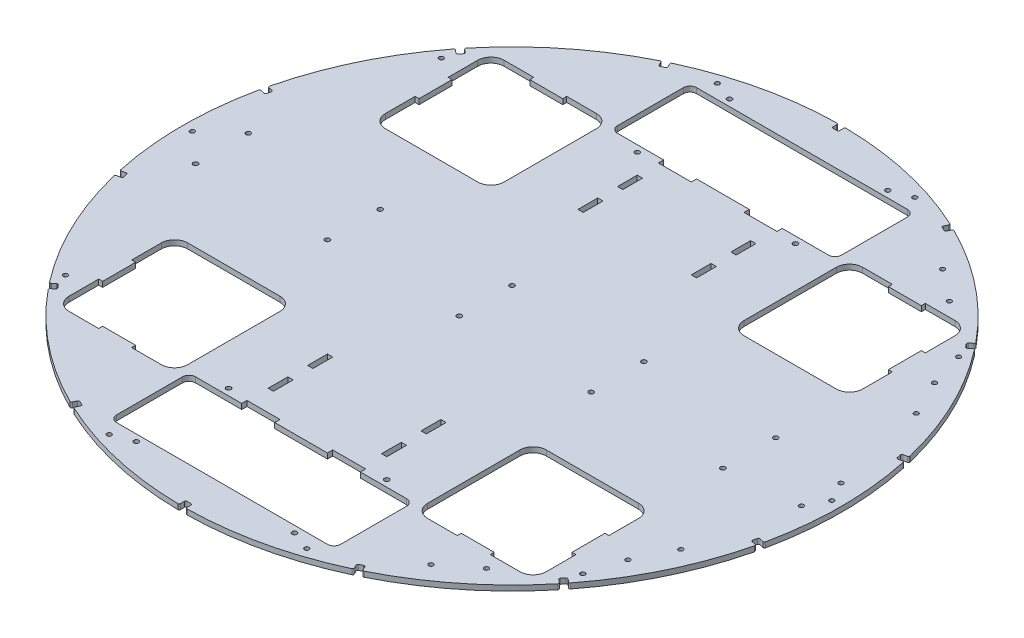
from build123d import *

# Parameters (mm, degrees)
SKETCH1_R                = 250
BOSS_EXTRUDE1_DEPTH      = 4
CUT_EXTRUDE1_DEPTH       = 10
SKETCH3_W                = 25
SKETCH3_H                = 4
CUT_EXTRUDE2_DEPTH       = 5
SKETCH4_W                = 4
SKETCH4_H                = 15
CUT_EXTRUDE3_DEPTH       = 20
CUT_EXTRUDE4_DEPTH       = 5
SKETCH8_W                = 6
SKETCH8_H                = 25
SKETCH8_W_2              = 25
SKETCH8_H_2              = 6
BOSS_EXTRUDE2_DEPTH      = 4
CUT_EXTRUDE5_DEPTH       = 4
FILLET1_R                = 1
CIRPATTERN1_COUNT        = 14
FILLET1_OF_CIRPATTERN1_R = 1
SKETCH12_R               = 1.7
CUT_EXTRUDE6_DEPTH       = 10
CIRPATTERN2_COUNT        = 10
SKETCH13_R               = 1.7
CUT_EXTRUDE7_DEPTH       = 10
SKETCH14_R               = 1.8
CUT_EXTRUDE8_DEPTH       = 10
SKETCH15_R               = 1.8
CUT_EXTRUDE9_DEPTH       = 10


with BuildPart() as part:
    # Sketch1 → Boss-Extrude1 (new body)
    with BuildSketch(Plane(origin=(0, 0, 0), x_dir=(1, 0, 0), z_dir=(0, 1, 0))):
        with Locations(Location((0, 0, 0), (0, 0, 270))):
            Circle(SKETCH1_R)
    extrude(amount=BOSS_EXTRUDE1_DEPTH)

    # Sketch2 → Cut-Extrude1 (cut)
    with BuildSketch(Plane(origin=(0, 4, 0), x_dir=(1, 0, 0), z_dir=(0, 1, 0))):
        with BuildLine():
            Line((80, 220), (-80, 220))
            ThreePointArc((-80, 220), (-83.535533906, 218.535533906), (-85, 215))
            Line((-85, 215), (-85, 165))
            ThreePointArc((-85, 165), (-83.535533906, 161.464466094), (-80, 160))
            Line((-80, 160), (80, 160))
            ThreePointArc((80, 160), (83.535533906, 161.464466094), (85, 165))
            Line((85, 165), (85, 215))
            ThreePointArc((85, 215), (83.535533906, 218.535533906), (80, 220))
        make_face()
        with BuildLine():
            Line((85, -215), (85, -165))
            ThreePointArc((85, -165), (83.535533906, -161.464466094), (80, -160))
            Line((80, -160), (-80, -160))
            ThreePointArc((-80, -160), (-83.535533906, -161.464466094), (-85, -165))
            Line((-85, -165), (-85, -215))
            ThreePointArc((-85, -215), (-83.535533906, -218.535533906), (-80, -220))
            Line((-80, -220), (80, -220))
            ThreePointArc((80, -220), (83.535533906, -218.535533906), (85, -215))
        make_face()
    extrude(amount=-CUT_EXTRUDE1_DEPTH, mode=Mode.SUBTRACT)

    # Sketch3 → Cut-Extrude2 (cut)
    with BuildSketch(Plane(origin=(0, 4, 0), x_dir=(1, 0, 0), z_dir=(0, 1, 0))):
        with Locations((-32.5, 158)):
            Rectangle(SKETCH3_W, SKETCH3_H)
        with Locations((32.5, 158)):
            Rectangle(SKETCH3_W, SKETCH3_H)
        with Locations((-32.5, -158)):
            Rectangle(SKETCH3_W, SKETCH3_H)
        with Locations((32.5, -158)):
            Rectangle(SKETCH3_W, SKETCH3_H)
    extrude(amount=-CUT_EXTRUDE2_DEPTH, mode=Mode.SUBTRACT)

    # Sketch4 → Cut-Extrude3 (cut)
    with BuildSketch(Plane(origin=(0, 4, 0), x_dir=(1, 0, 0), z_dir=(0, 1, 0))):
        with Locations((43, 132.5)):
            Rectangle(SKETCH4_W, SKETCH4_H)
        with Locations((43, 102.5)):
            Rectangle(SKETCH4_W, SKETCH4_H)
        with Locations((-43, 132.5)):
            Rectangle(SKETCH4_W, SKETCH4_H)
        with Locations((-43, 102.5)):
            Rectangle(SKETCH4_W, SKETCH4_H)
        with Locations((-43, -102.5)):
            Rectangle(SKETCH4_W, SKETCH4_H)
        with Locations((-43, -132.5)):
            Rectangle(SKETCH4_W, SKETCH4_H)
        with Locations((43, -102.5)):
            Rectangle(SKETCH4_W, SKETCH4_H)
        with Locations((43, -132.5)):
            Rectangle(SKETCH4_W, SKETCH4_H)
    extrude(amount=-CUT_EXTRUDE3_DEPTH, mode=Mode.SUBTRACT)

    # Sketch7 → Cut-Extrude4 (cut)
    with BuildSketch(Plane(origin=(0, 4, 0), x_dir=(1, 0, 0), z_dir=(0, 1, 0))):
        with BuildLine():
            Line((-101, 75), (-171, 75))
            ThreePointArc((-171, 75), (-178.071067812, 77.928932188), (-181, 85))
            Line((-181, 85), (-181, 155))
            ThreePointArc((-181, 155), (-178.071067812, 162.071067812), (-171, 165))
            Line((-171, 165), (-101, 165))
            ThreePointArc((-101, 165), (-93.928932188, 162.071067812), (-91, 155))
            Line((-91, 155), (-91, 85))
            ThreePointArc((-91, 85), (-93.928932188, 77.928932188), (-101, 75))
        make_face()
        with BuildLine():
            Line((181, 85), (181, 155))
            ThreePointArc((181, 155), (178.071067812, 162.071067812), (171, 165))
            Line((171, 165), (101, 165))
            ThreePointArc((101, 165), (93.928932188, 162.071067812), (91, 155))
            Line((91, 155), (91, 85))
            ThreePointArc((91, 85), (93.928932188, 77.928932188), (101, 75))
            Line((101, 75), (171, 75))
            ThreePointArc((171, 75), (178.071067812, 77.928932188), (181, 85))
        make_face()
        with BuildLine():
            Line((101, -75), (171, -75))
            ThreePointArc((171, -75), (178.071067812, -77.928932188), (181, -85))
            Line((181, -85), (181, -155))
            ThreePointArc((181, -155), (178.071067812, -162.071067812), (171, -165))
            Line((171, -165), (101, -165))
            ThreePointArc((101, -165), (93.928932188, -162.071067812), (91, -155))
            Line((91, -155), (91, -85))
            ThreePointArc((91, -85), (93.928932188, -77.928932188), (101, -75))
        make_face()
        with BuildLine():
            Line((-181, -85), (-181, -155))
            ThreePointArc((-181, -155), (-178.071067812, -162.071067812), (-171, -165))
            Line((-171, -165), (-101, -165))
            ThreePointArc((-101, -165), (-93.928932188, -162.071067812), (-91, -155))
            Line((-91, -155), (-91, -85))
            ThreePointArc((-91, -85), (-93.928932188, -77.928932188), (-101, -75))
            Line((-101, -75), (-171, -75))
            ThreePointArc((-171, -75), (-178.071067812, -77.928932188), (-181, -85))
        make_face()
    extrude(amount=-CUT_EXTRUDE4_DEPTH, mode=Mode.SUBTRACT)

    # Sketch8 → Boss-Extrude2 (add)
    with BuildSketch(Plane(origin=(0, 4, 0), x_dir=(1, 0, 0), z_dir=(0, 1, 0))):
        with Locations((-181, 120)):
            Rectangle(SKETCH8_W, SKETCH8_H)
        with Locations((-136, 165)):
            Rectangle(SKETCH8_W_2, SKETCH8_H_2)
        with Locations((136, 165)):
            Rectangle(SKETCH8_W_2, SKETCH8_H_2)
        with Locations((181, 120)):
            Rectangle(SKETCH8_W, SKETCH8_H)
        with Locations((181, -120)):
            Rectangle(SKETCH8_W, SKETCH8_H)
        with Locations((136, -165)):
            Rectangle(SKETCH8_W_2, SKETCH8_H_2)
        with Locations((-136, -165)):
            Rectangle(SKETCH8_W_2, SKETCH8_H_2)
        with Locations((-181, -120)):
            Rectangle(SKETCH8_W, SKETCH8_H)
    extrude(amount=-BOSS_EXTRUDE2_DEPTH)

    # Sketch11 → Cut-Extrude5 (cut)
    with BuildSketch(Plane(origin=(0, 4, 0), x_dir=(1, 0, 0), z_dir=(0, 1, 0))):
        with BuildLine():
            Line((1.5, 245), (-1.5, 245))
            ThreePointArc((-1.5, 245), (-2.207106781, 245.292893219), (-2.5, 246))
            Line((-2.5, 246), (-2.5, 255))
            Line((-2.5, 255), (2.5, 255))
            Line((2.5, 255), (2.5, 246))
            ThreePointArc((2.5, 246), (2.207106781, 245.292893219), (1.5, 245))
        make_face()
    cut_extrude5 = extrude(amount=-CUT_EXTRUDE5_DEPTH, mode=Mode.SUBTRACT)

    # Fillet1
    fillet1_edges = [part.edges().sort_by_distance(p)[0] for p in [
        (2.5, 2, -249.987499687),
        (-2.5, 2, -249.987499687),
    ]]
    fillet(fillet1_edges, radius=FILLET1_R)

    # CirPattern1: Cut-Extrude5 ×14 about axis
    cirpattern1_axis = Axis((0, 0, 0), (0, 1, 0))
    for i in range(1, CIRPATTERN1_COUNT):
        add(cut_extrude5.rotate(cirpattern1_axis, i * 360 / CIRPATTERN1_COUNT), mode=Mode.SUBTRACT)

    # Fillet1 of CirPattern1
    fillet1_of_cirpattern1_edges = [part.edges().sort_by_distance(p)[0] for p in [
        (-106.213088927, 2, -226.315663931),
        (-110.717933267, 2, -224.146245235),
        (-193.889372974, 2, -157.819235353),
        (-197.006821984, 2, -153.910077941),
        (-243.163488807, 2, -58.064771688),
        (-244.276093477, 2, -53.190132127),
        (-244.276093477, 2, 53.190132127),
        (-243.163488807, 2, 58.064771688),
        (-197.006821984, 2, 153.910077941),
        (-193.889372974, 2, 157.819235353),
        (-110.717933267, 2, 224.146245235),
        (-106.213088927, 2, 226.315663931),
        (-2.5, 2, 249.987499687),
        (2.5, 2, 249.987499687),
        (106.213088927, 2, 226.315663931),
        (110.717933267, 2, 224.146245235),
        (193.889372974, 2, 157.819235353),
        (197.006821984, 2, 153.910077941),
        (243.163488807, 2, 58.064771688),
        (244.276093477, 2, 53.190132127),
        (244.276093477, 2, -53.190132127),
        (243.163488807, 2, -58.064771688),
        (197.006821984, 2, -153.910077941),
        (193.889372974, 2, -157.819235353),
        (110.717933267, 2, -224.146245235),
        (106.213088927, 2, -226.315663931),
    ]]
    fillet(fillet1_of_cirpattern1_edges, radius=FILLET1_OF_CIRPATTERN1_R)

    # Sketch12 → Cut-Extrude6 (cut)
    with BuildSketch(Plane(origin=(0, 4, 0), x_dir=(1, 0, 0), z_dir=(0, 1, 0))):
        with Locations(Location((-242.5, 0, 0), (0, 0, 270))):
            Circle(SKETCH12_R)
    cut_extrude6 = extrude(amount=-CUT_EXTRUDE6_DEPTH, mode=Mode.SUBTRACT)

    # CirPattern2: Cut-Extrude6 ×10 about axis
    cirpattern2_axis = Axis((0, 0, 0), (0, 1, 0))
    for i in range(1, CIRPATTERN2_COUNT):
        add(cut_extrude6.rotate(cirpattern2_axis, i * 360 / CIRPATTERN2_COUNT), mode=Mode.SUBTRACT)

    # Sketch13 → Cut-Extrude7 (cut)
    with BuildSketch(Plane(origin=(0, 4, 0), x_dir=(1, 0, 0), z_dir=(0, 1, 0))):
        with Locations(Location((234.5, 15, 0), (0, 0, 270))):
            Circle(SKETCH13_R)
        with Locations(Location((234.5, -15, 0), (0, 0, 270))):
            Circle(SKETCH13_R)
        with Locations(Location((217.342771059, -89.316123228, 0), (0, 0, 270))):
            Circle(SKETCH13_R)
        with Locations(Location((204.191636655, -116.279944617, 0), (0, 0, 270))):
            Circle(SKETCH13_R)
        with Locations(Location((156.192777268, -175.553599591, 0), (0, 0, 270))):
            Circle(SKETCH13_R)
        with Locations(Location((132.55245466, -194.023443851, 0), (0, 0, 270))):
            Circle(SKETCH13_R)
        with Locations(Location((204.191636655, 116.279944617, 0), (0, 0, 270))):
            Circle(SKETCH13_R)
        with Locations(Location((217.342771059, 89.316123228, 0), (0, 0, 270))):
            Circle(SKETCH13_R)
        with Locations(Location((132.55245466, 194.023443851, 0), (0, 0, 270))):
            Circle(SKETCH13_R)
        with Locations(Location((156.192777268, 175.553599591, 0), (0, 0, 270))):
            Circle(SKETCH13_R)
    extrude(amount=-CUT_EXTRUDE7_DEPTH, mode=Mode.SUBTRACT)

    # Sketch14 → Cut-Extrude8 (cut)
    with BuildSketch(Plane(origin=(0, 4, 0), x_dir=(1, 0, 0), z_dir=(0, 1, 0))):
        with Locations(Location((-220, 20, 0), (0, 0, 270))):
            Circle(SKETCH14_R)
        with Locations(Location((-220, -20, 0), (0, 0, 270))):
            Circle(SKETCH14_R)
        with Locations(Location((-120, 20, 0), (0, 0, 270))):
            Circle(SKETCH14_R)
        with Locations(Location((-120, -20, 0), (0, 0, 270))):
            Circle(SKETCH14_R)
        with Locations(Location((-20, 20, 0), (0, 0, 270))):
            Circle(SKETCH14_R)
        with Locations(Location((-20, -20, 0), (0, 0, 270))):
            Circle(SKETCH14_R)
        with Locations(Location((80, 20, 0), (0, 0, 270))):
            Circle(SKETCH14_R)
        with Locations(Location((80, -20, 0), (0, 0, 270))):
            Circle(SKETCH14_R)
        with Locations(Location((180, 20, 0), (0, 0, 270))):
            Circle(SKETCH14_R)
        with Locations(Location((180, -20, 0), (0, 0, 270))):
            Circle(SKETCH14_R)
    extrude(amount=-CUT_EXTRUDE8_DEPTH, mode=Mode.SUBTRACT)

    # Sketch15 → Cut-Extrude9 (cut)
    with BuildSketch(Plane(origin=(0, 4, 0), x_dir=(1, 0, 0), z_dir=(0, 1, 0))):
        with Locations(Location((-60, -225, 0), (0, 0, 270))):
            Circle(SKETCH15_R)
        with Locations(Location((60, -225, 0), (0, 0, 270))):
            Circle(SKETCH15_R)
        with Locations(Location((-60, -155, 0), (0, 0, 270))):
            Circle(SKETCH15_R)
        with Locations(Location((60, -155, 0), (0, 0, 270))):
            Circle(SKETCH15_R)
        with Locations(Location((60, 155, 0), (0, 0, 270))):
            Circle(SKETCH15_R)
        with Locations(Location((-60, 155, 0), (0, 0, 270))):
            Circle(SKETCH15_R)
        with Locations(Location((60, 225, 0), (0, 0, 270))):
            Circle(SKETCH15_R)
        with Locations(Location((-60, 225, 0), (0, 0, 270))):
            Circle(SKETCH15_R)
    extrude(amount=-CUT_EXTRUDE9_DEPTH, mode=Mode.SUBTRACT)


solid = part.part
